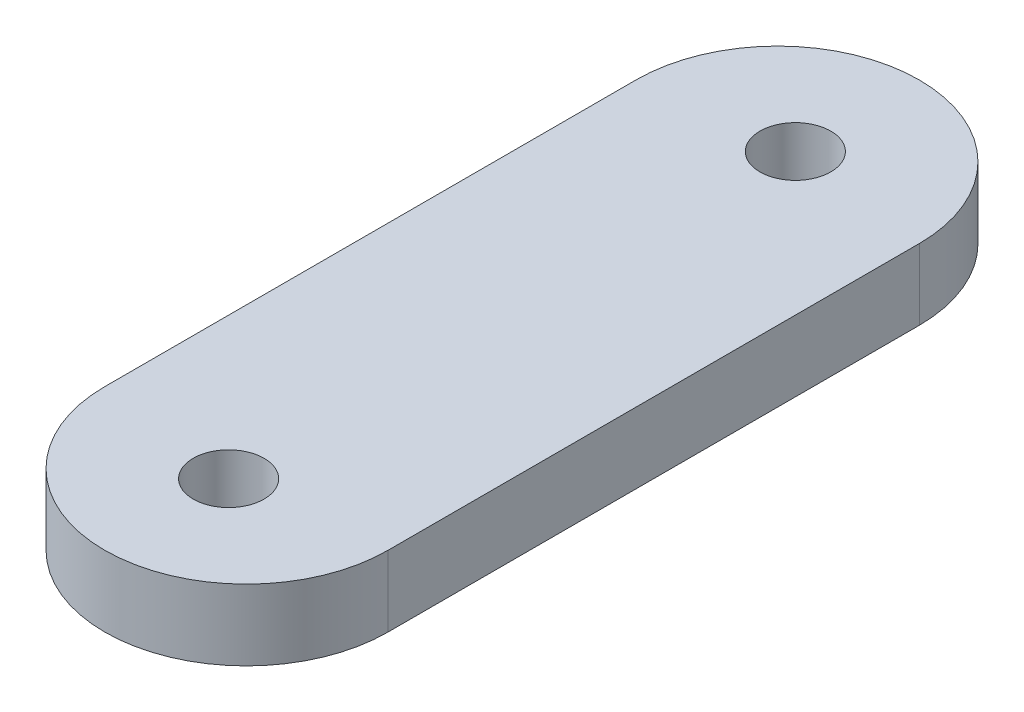
from build123d import *

# Parameters (mm, degrees)
SKETCH1_W           = 16
SKETCH1_H           = 46
SKETCH1_R           = 2
BOSS_EXTRUDE1_DEPTH = 4
FILLET1_RADIUS      = 8
FILLET1_LENGTH      = 4
FILLET2_RADIUS      = 8
FILLET2_LENGTH      = 4


with BuildPart() as part:
    # Sketch1 → Boss-Extrude1 (new body)
    with BuildSketch(Plane(origin=(0, 0, 0), x_dir=(1, 0, 0), z_dir=(0, 1, 0))):
        Rectangle(SKETCH1_W, SKETCH1_H)
        with Locations(Location((0, -16, 0), (0, 0, 270))):
            Circle(SKETCH1_R, mode=Mode.SUBTRACT)
        with Locations(Location((0, 16, 0), (0, 0, 270))):
            Circle(SKETCH1_R, mode=Mode.SUBTRACT)
    extrude(amount=BOSS_EXTRUDE1_DEPTH)

    # Fillet1: full round fillet: the end face becomes a half cylinder, R = half its width
    fillet1_face = Plane((0, 2, 23), x_dir=(0, 1, 0), z_dir=(0, 0, 1))  # on the end face: x along it, z out of the body
    fillet1_slab = fillet1_face.offset(-FILLET1_RADIUS / 2) * Box(FILLET1_LENGTH, 2 * FILLET1_RADIUS, FILLET1_RADIUS, mode=Mode.PRIVATE)  # the body's end, R deep
    fillet1_round = Plane((0, 2, 15), x_dir=(0, 0, 1), z_dir=(0, 1, 0)) * Cylinder(FILLET1_RADIUS, FILLET1_LENGTH, mode=Mode.PRIVATE)  # its axis R under the face
    add(fillet1_slab - fillet1_round, mode=Mode.SUBTRACT)

    # Fillet2: full round fillet: the end face becomes a half cylinder, R = half its width
    fillet2_face = Plane((0, 2, -23), x_dir=(0, 1, 0), z_dir=(0, 0, -1))  # on the end face: x along it, z out of the body
    fillet2_slab = fillet2_face.offset(-FILLET2_RADIUS / 2) * Box(FILLET2_LENGTH, 2 * FILLET2_RADIUS, FILLET2_RADIUS, mode=Mode.PRIVATE)  # the body's end, R deep
    fillet2_round = Plane((0, 2, -15), x_dir=(0, 0, -1), z_dir=(0, 1, 0)) * Cylinder(FILLET2_RADIUS, FILLET2_LENGTH, mode=Mode.PRIVATE)  # its axis R under the face
    add(fillet2_slab - fillet2_round, mode=Mode.SUBTRACT)


solid = part.part
